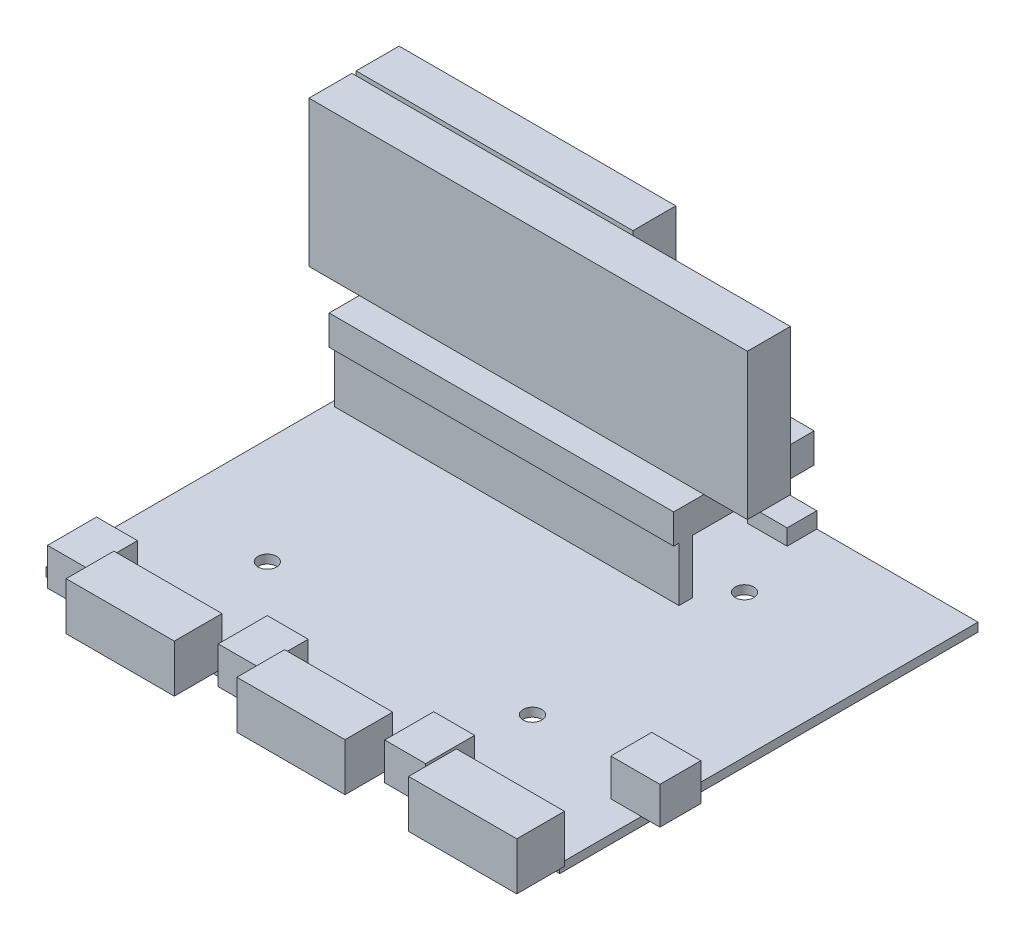
from build123d import *

# Parameters (mm, degrees)
SKETCH1_W             = 96.9
SKETCH1_H             = 78.9
BOSS_EXTRUDE1_DEPTH   = 1.64
SKETCH2_W             = 7.72
SKETCH2_H             = 9.25
SKETCH2_W_2           = 9.26
SKETCH2_H_2           = 7.72
BOSS_EXTRUDE2_DEPTH   = 7
SKETCH3_W             = 20.4
SKETCH3_H             = 9
BOSS_EXTRUDE5_DEPTH   = 9
BOSS_EXTRUDE5_2_DEPTH = 9
BOSS_EXTRUDE5_3_DEPTH = 9
SKETCH4_W             = 7.5
SKETCH4_H             = 5.6
BOSS_EXTRUDE6_DEPTH   = 3
SKETCH6_W             = 51.2
SKETCH6_H             = 2.5
SKETCH6_W_2           = 65
BOSS_EXTRUDE7_DEPTH   = 10.2
SKETCH7_W             = 65
SKETCH7_H             = 26.5
BOSS_EXTRUDE8_DEPTH   = 5.6
SKETCH8_W             = 52.2
SKETCH8_H             = 8.1
SKETCH8_W_2           = 82.7
BOSS_EXTRUDE9_DEPTH   = 27.5
SKETCH10_R            = 1.75
CUT_EXTRUDE1_DEPTH    = 2


with BuildPart() as part:
    # Sketch1 → Boss-Extrude1 (new body)
    with BuildSketch(Plane(origin=(0, 0, 0), x_dir=(1, 0, 0), z_dir=(0, 1, 0))):
        with Locations((48.45, 39.45)):
            Rectangle(SKETCH1_W, SKETCH1_H)
    extrude(amount=BOSS_EXTRUDE1_DEPTH)

    # Sketch2 → Boss-Extrude2 (add)
    with BuildSketch(Plane(origin=(0, 1.64, 0), x_dir=(1, 0, 0), z_dir=(0, 1, 0))):
        with Locations((39.66, 1.315)):
            Rectangle(SKETCH2_W, SKETCH2_H)
        with Locations((7.46, 1.315)):
            Rectangle(SKETCH2_W, SKETCH2_H)
        with Locations((71.06, 1.315)):
            Rectangle(SKETCH2_W, SKETCH2_H)
        with Locations((95.77, 19.26)):
            Rectangle(SKETCH2_W_2, SKETCH2_H_2)
    extrude(amount=BOSS_EXTRUDE2_DEPTH)

    # Sketch4 → Boss-Extrude6 (add)
    with BuildSketch(Plane(origin=(0, 1.64, 0), x_dir=(1, 0, 0), z_dir=(0, 1, 0))):
        with Locations((62.75, 76.1)):
            Rectangle(SKETCH4_W, SKETCH4_H)
    extrude(amount=BOSS_EXTRUDE6_DEPTH)

    # Sketch6 → Boss-Extrude7 (add)
    with BuildSketch(Plane(origin=(0, 1.64, 0), x_dir=(1, 0, 0), z_dir=(0, 1, 0))):
        with Locations((26.6, 77.65)):
            Rectangle(SKETCH6_W, SKETCH6_H)
        with Locations((33.5, 54.65)):
            Rectangle(SKETCH6_W_2, SKETCH6_H)
    extrude(amount=BOSS_EXTRUDE7_DEPTH)

    # Sketch7 → Boss-Extrude8 (add)
    with BuildSketch(Plane(origin=(0, 11.84, 0), x_dir=(1, 0, 0), z_dir=(0, 1, 0))):
        with Locations((33.5, 65.65)):
            Rectangle(SKETCH7_W, SKETCH7_H)
    extrude(amount=BOSS_EXTRUDE8_DEPTH)

    # Sketch8 → Boss-Extrude9 (add)
    with BuildSketch(Plane(origin=(0, 17.44, 0), x_dir=(1, 0, 0), z_dir=(0, 1, 0))):
        with Locations((17.6, 71.05)):
            Rectangle(SKETCH8_W, SKETCH8_H)
        with Locations((32.85, 62.15)):
            Rectangle(SKETCH8_W_2, SKETCH8_H)
    extrude(amount=BOSS_EXTRUDE9_DEPTH)

    # Sketch10 → Cut-Extrude1 (cut)
    with BuildSketch(Plane.XZ):
        with Locations(Location((20, -21.75, 0), (0, 0, 270))):
            Circle(SKETCH10_R)
        with Locations(Location((70, -21.75, 0), (0, 0, 270))):
            Circle(SKETCH10_R)
        with Locations(Location((20, -61.75, 0), (0, 0, 270))):
            Circle(SKETCH10_R)
        with Locations(Location((70, -61.75, 0), (0, 0, 270))):
            Circle(SKETCH10_R)
    extrude(amount=-CUT_EXTRUDE1_DEPTH, mode=Mode.SUBTRACT)


with BuildPart() as body_2:
    # Sketch3 → Boss-Extrude5 (new body)
    with BuildSketch(Plane(origin=(0, 1.64, 0), x_dir=(1, 0, 0), z_dir=(0, 1, 0))):
        with Locations((23, -4.5)):
            Rectangle(SKETCH3_W, SKETCH3_H)
    extrude(amount=BOSS_EXTRUDE5_DEPTH)


with BuildPart() as body_3:
    # Sketch3 → Boss-Extrude5 2 (new body)
    with BuildSketch(Plane(origin=(0, 1.64, 0), x_dir=(1, 0, 0), z_dir=(0, 1, 0))):
        with Locations((55.2, -4.5)):
            Rectangle(SKETCH3_W, SKETCH3_H)
    extrude(amount=BOSS_EXTRUDE5_2_DEPTH)


with BuildPart() as body_4:
    # Sketch3 → Boss-Extrude5 3 (new body)
    with BuildSketch(Plane(origin=(0, 1.64, 0), x_dir=(1, 0, 0), z_dir=(0, 1, 0))):
        with Locations((87.6, -4.5)):
            Rectangle(SKETCH3_W, SKETCH3_H)
    extrude(amount=BOSS_EXTRUDE5_3_DEPTH)


solid = Compound([part.part, body_2.part, body_3.part, body_4.part])
